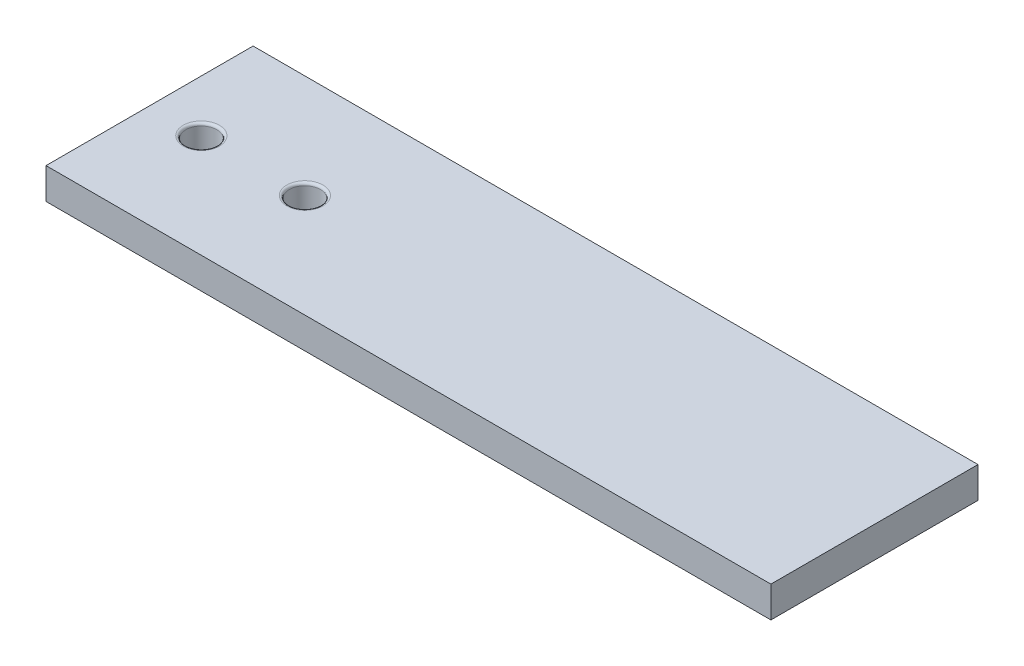
from build123d import *

# Parameters (mm, degrees)
SKETCH1_W           = 140
SKETCH1_H           = 40
SKETCH1_R           = 3
BOSS_EXTRUDE1_DEPTH = 3
FILLET1_R           = 0.5


with BuildPart() as part:
    # Sketch1 → Boss-Extrude1 (new, symmetric)
    with BuildSketch(Plane(origin=(0, 0, 0), x_dir=(1, 0, 0), z_dir=(0, 1, 0))):
        Rectangle(SKETCH1_W, SKETCH1_H)
        with Locations(Location((-40, 0, 0), (0, 0, 270))):
            Circle(SKETCH1_R, mode=Mode.SUBTRACT)
        with Locations(Location((-60, 0, 0), (0, 0, 270))):
            Circle(SKETCH1_R, mode=Mode.SUBTRACT)
    extrude(amount=BOSS_EXTRUDE1_DEPTH, both=True)

    # Fillet1
    fillet1_edges = [part.edges().sort_by_distance(p)[0] for p in [
        (-40, 3, -3),
        (-60, 3, -3),
    ]]
    fillet(fillet1_edges, radius=FILLET1_R)


solid = part.part
